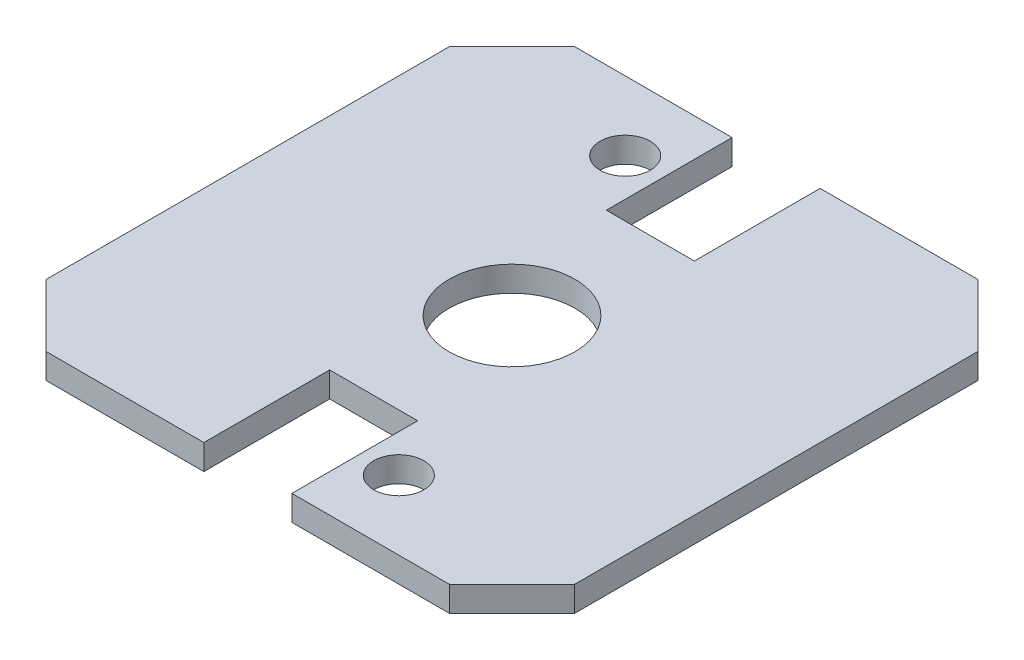
from build123d import *

# Parameters (mm, degrees)
SKETCH1_W           = 42
SKETCH1_H           = 42
BOSS_EXTRUDE1_DEPTH = 2
CUT_EXTRUDE1_DEPTH  = 10
SKETCH3_R           = 5
CUT_EXTRUDE2_DEPTH  = 10
SKETCH4_R           = 2
CUT_EXTRUDE3_DEPTH  = 10
SKETCH5_W           = 7
SKETCH5_H           = 10
CUT_EXTRUDE4_DEPTH  = 4


with BuildPart() as part:
    # Sketch1 → Boss-Extrude1 (new body)
    with BuildSketch(Plane(origin=(0, 0, 0), x_dir=(1, 0, 0), z_dir=(0, 1, 0))):
        Rectangle(SKETCH1_W, SKETCH1_H)
    extrude(amount=BOSS_EXTRUDE1_DEPTH)

    # Sketch2 → Cut-Extrude1 (cut)
    with BuildSketch(Plane(origin=(0, 2, 0), x_dir=(1, 0, 0), z_dir=(0, 1, 0))):
        Polygon((-16.050252532, 21), (-21, 21), (-21, 16.050252532), align=None)
        Polygon((21, 21), (16.050252532, 21), (21, 16.050252532), align=None)
        Polygon((21, -16.050252532), (16.050252532, -21), (21, -21), align=None)
        Polygon((-16.050252532, -21), (-21, -16.050252532), (-21, -21), align=None)
    extrude(amount=-CUT_EXTRUDE1_DEPTH, mode=Mode.SUBTRACT)

    # Sketch3 → Cut-Extrude2 (cut)
    with BuildSketch(Plane(origin=(0, 2, 0), x_dir=(1, 0, 0), z_dir=(0, 1, 0))):
        with Locations(Location((0, 0, 0), (0, 0, 270))):
            Circle(SKETCH3_R)
    extrude(amount=-CUT_EXTRUDE2_DEPTH, mode=Mode.SUBTRACT)

    # Sketch4 → Cut-Extrude3 (cut)
    with BuildSketch(Plane.XZ):
        with Locations(Location((6.5, 15.5, 0), (0, 0, 270))):
            Circle(SKETCH4_R)
        with Locations(Location((-6.5, -15.5, 0), (0, 0, 270))):
            Circle(SKETCH4_R)
    extrude(amount=-CUT_EXTRUDE3_DEPTH, mode=Mode.SUBTRACT)

    # Sketch5 → Cut-Extrude4 (cut)
    with BuildSketch(Plane.XZ):
        with Locations((0, -16)):
            Rectangle(SKETCH5_W, SKETCH5_H)
        with Locations((0, 16)):
            Rectangle(SKETCH5_W, SKETCH5_H)
    extrude(amount=-CUT_EXTRUDE4_DEPTH, mode=Mode.SUBTRACT)


solid = part.part
